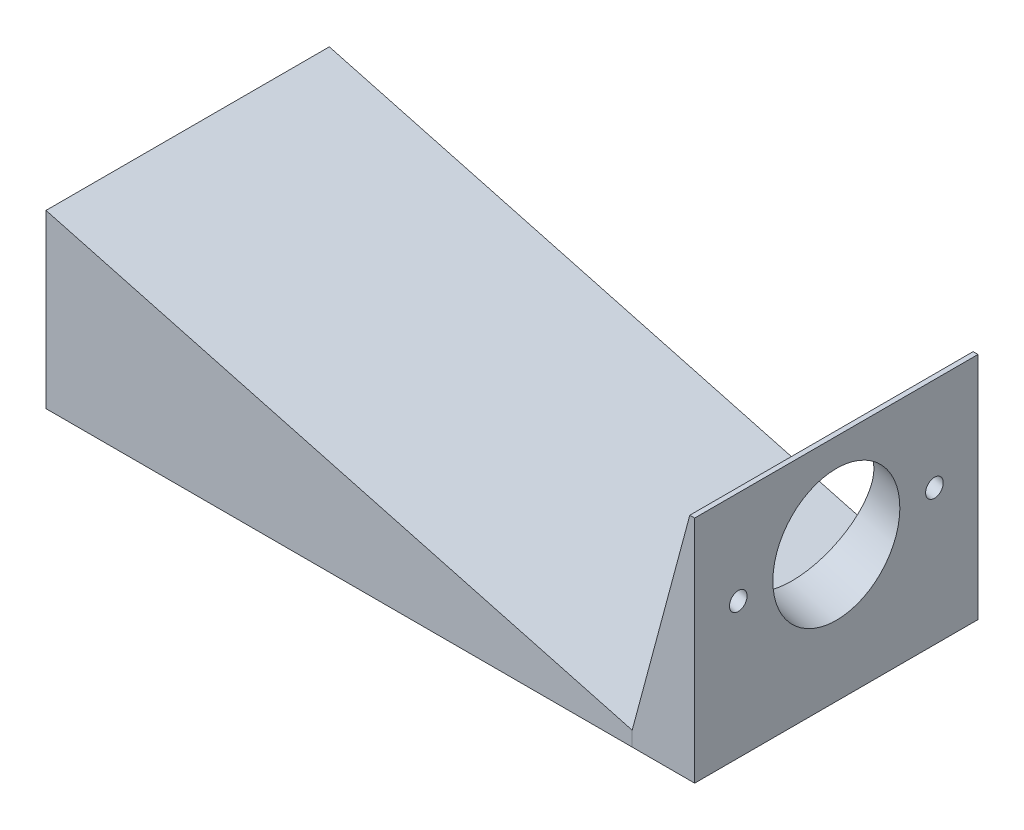
from build123d import *

# Parameters (mm, degrees)
SALIENTE_EXTRUIR1_DEPTH = 29
SALIENTE_EXTRUIR2_DEPTH = 29
CROQUIS6_R              = 6.5
CORTAR_EXTRUIR1_DEPTH   = 72.523490549
CROQUIS9_R              = 6.5
CROQUIS9_R_2            = 0.9
CORTAR_EXTRUIR2_DEPTH   = 72.523490549


with BuildPart() as part:
    # Croquis1 → Saliente-Extruir1 (new body)
    with BuildSketch(Plane.XY):
        Polygon((-30, 0), (30, 0), (30, 1.5), (-30, 17.576951546), align=None)
    extrude(amount=-SALIENTE_EXTRUIR1_DEPTH)


with BuildPart() as body_2:
    # Croquis3 → Saliente-Extruir2 (new body)
    with BuildSketch(Plane.XY):
        Polygon((30, 0), (30, 1.5), (35.89617112, 23.50481019), (36.39617112, 23.50481019), (36.39617112, 0), align=None)
    extrude(amount=-SALIENTE_EXTRUIR2_DEPTH)

    # Croquis6 → Cortar-Extruir1 (cut, through all)
    with BuildSketch(Plane(origin=(27.615381057, -7.399519053, 0), x_dir=(0, 0, 1), z_dir=(-0.9659258262890692, 0.25881904510251774, 0))):
        with Locations(Location((-14.5, 22.863460093, 0), (0, 0, 270))):
            Circle(CROQUIS6_R)
    extrude(amount=-CORTAR_EXTRUIR1_DEPTH, mode=Mode.SUBTRACT)

    # Croquis9 → Cortar-Extruir2 (cut, through all)
    with BuildSketch(Plane(origin=(27.615381057, -7.399519053, 0), x_dir=(0, 0, 1), z_dir=(-0.9659258262890692, 0.25881904510251774, 0))):
        with Locations(Location((-14.5, 22.863460093, 0), (0, 0, 270))):
            Circle(CROQUIS9_R)
        with Locations(Location((-24.54, 22.863460093, 0), (0, 0, 270))):
            Circle(CROQUIS9_R_2)
        with Locations(Location((-4.46, 22.863460093, 0), (0, 0, 90))):
            Circle(CROQUIS9_R_2)
    extrude(amount=-CORTAR_EXTRUIR2_DEPTH, mode=Mode.SUBTRACT)


solid = Compound([part.part, body_2.part])
